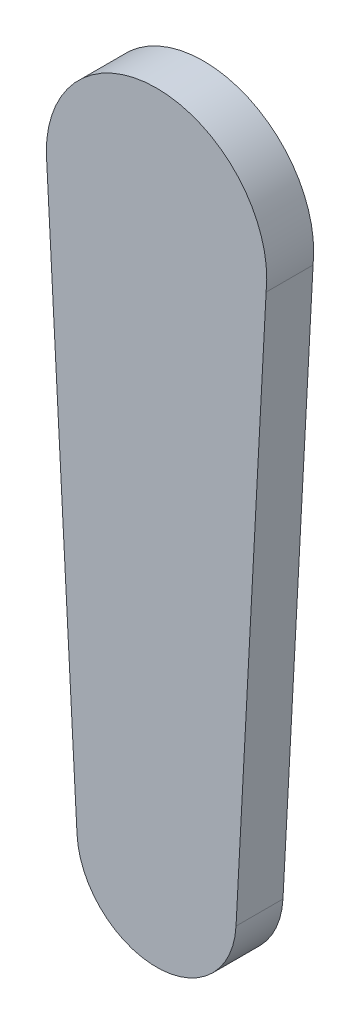
from build123d import *

# Parameters (mm, degrees)
SKETCH_1_R      = 27
EXTRUDE_1_DEPTH = 11.5
EXTRUDE_2_DEPTH = 11.5


with BuildPart() as part:
    # 草图1 → 凸台-拉伸1 (new body)
    with BuildSketch(Plane.XY):
        with Locations((0, 70)):
            Circle(SKETCH_1_R)
    extrude(amount=EXTRUDE_1_DEPTH)

    # 草图1<5> → 凸台-拉伸2 (add)
    with BuildSketch(Plane.XY):
        with BuildLine():
            Line((-26.846607376, 67.126035423), (-19.472284413, -71.039297708))
            ThreePointArc((-19.472284413, -71.039297708), (0, -89.5), (19.472284413, -71.039297708))
            Line((19.472284413, -71.039297708), (26.846607376, 67.126035423))
            ThreePointArc((26.846607376, 67.126035423), (0, 43), (-26.846607376, 67.126035423))
        make_face()
    extrude(amount=EXTRUDE_2_DEPTH)


solid = part.part
